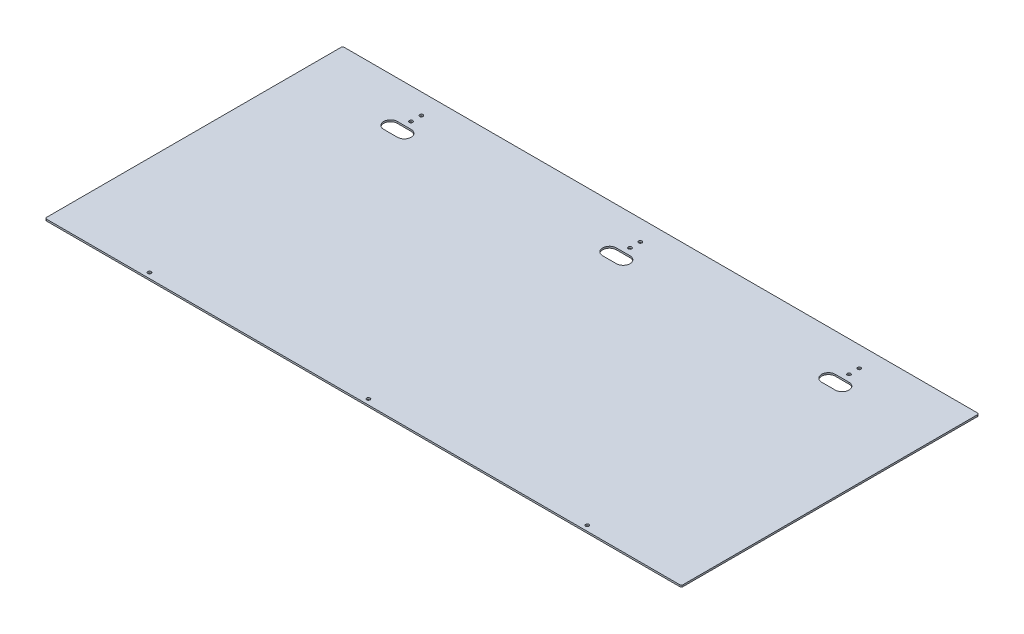
from build123d import *

# Parameters (mm, degrees)
BOSS_EXTRUDE1_DEPTH         = 3.175
F_1_4_0_25_DIAMETER_HOLE1_D = 6.35
CUT_EXTRUDE1_DEPTH          = 652.965975914


with BuildPart() as part:
    # Sketch1 → Boss-Extrude1 (new body)
    with BuildSketch(Plane(origin=(0, 0, 0), x_dir=(1, 0, 0), z_dir=(0, 1, 0))):
        with BuildLine():
            Line((-587.375, -276.225), (587.375, -276.225))
            ThreePointArc((587.375, -276.225), (589.62006403, -275.29506403), (590.55, -273.05))
            Line((590.55, -273.05), (590.55, 273.05))
            ThreePointArc((590.55, 273.05), (589.62006403, 275.29506403), (587.375, 276.225))
            Line((587.375, 276.225), (-587.375, 276.225))
            ThreePointArc((-587.375, 276.225), (-589.62006403, 275.29506403), (-590.55, 273.05))
            Line((-590.55, 273.05), (-590.55, -273.05))
            ThreePointArc((-590.55, -273.05), (-589.62006403, -275.29506403), (-587.375, -276.225))
        make_face()
    extrude(amount=BOSS_EXTRUDE1_DEPTH)

    # 1/4 (0.25) Diameter Hole1 (through all)
    with Locations(Plane(origin=(0, 3.175, 0), x_dir=(1, 0, 0), z_dir=(0, 1, 0))):
        with Locations((-406.4, 219.075), (0, 219.075), (406.4, 219.075), (-406.4, -266.573), (0, -266.573), (406.4, -266.573), (-406.4, 238.125), (0, 238.125), (406.4, 238.125)):
            Hole(F_1_4_0_25_DIAMETER_HOLE1_D / 2)

    # Sketch5 → Cut-Extrude1 (cut, through all)
    with BuildSketch(Plane(origin=(0, 3.175, 0), x_dir=(1, 0, 0), z_dir=(0, 1, 0))):
        with BuildLine():
            Line((-419.1, 206.375), (-393.7, 206.375))
            ThreePointArc((-393.7, 206.375), (-381, 193.675), (-393.7, 180.975))
            Line((-393.7, 180.975), (-419.1, 180.975))
            ThreePointArc((-419.1, 180.975), (-431.8, 193.675), (-419.1, 206.375))
        make_face()
        with BuildLine():
            Line((-12.7, 206.375), (12.7, 206.375))
            ThreePointArc((12.7, 206.375), (25.4, 193.675), (12.7, 180.975))
            Line((12.7, 180.975), (-12.7, 180.975))
            ThreePointArc((-12.7, 180.975), (-25.4, 193.675), (-12.7, 206.375))
        make_face()
        with BuildLine():
            Line((393.7, 206.375), (419.1, 206.375))
            ThreePointArc((419.1, 206.375), (431.8, 193.675), (419.1, 180.975))
            Line((419.1, 180.975), (393.7, 180.975))
            ThreePointArc((393.7, 180.975), (381, 193.675), (393.7, 206.375))
        make_face()
    extrude(amount=-CUT_EXTRUDE1_DEPTH, mode=Mode.SUBTRACT)


solid = part.part
